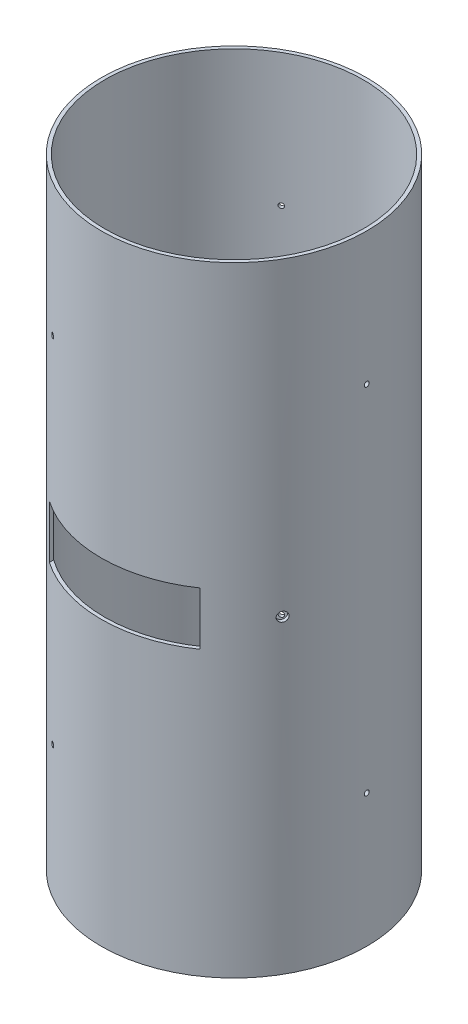
from build123d import *

# Parameters (mm, degrees)
SKETCH1_R               = 76.2
SKETCH1_R_2             = 74.168
BOSS_EXTRUDE1_DEPTH     = 355.6
SKETCH2_W               = 86.36
SKETCH2_H               = 30.48
CUT_EXTRUDE1_DEPTH      = 90.424
SKETCH3_R               = 2.7305
CUT_EXTRUDE2_DEPTH      = 2.54
CIRPATTERN1_COUNT       = 4
CIRPATTERN1_ANGLE       = 240
CUT_EXTRUDE3_REACH      = 378.288
CUT_EXTRUDE3_END_RADIUS = 76.2
SKETCH4_R               = 1.41224
CIRPATTERN2_COUNT       = 3


with BuildPart() as part:
    # Sketch1 → Boss-Extrude1 (new body)
    with BuildSketch(Plane(origin=(0, 0, 0), x_dir=(1, 0, 0), z_dir=(0, 1, 0))):
        with Locations(Location((0, 0, 0), (0, 0, 270))):
            Circle(SKETCH1_R)
        with Locations(Location((0, 0, 0), (0, 0, 270))):
            Circle(SKETCH1_R_2, mode=Mode.SUBTRACT)
    extrude(amount=BOSS_EXTRUDE1_DEPTH)

    # Sketch2 → Cut-Extrude1 (cut)
    with BuildSketch(Plane.XY):
        with Locations((0, 177.8)):
            Rectangle(SKETCH2_W, SKETCH2_H)
    extrude(amount=CUT_EXTRUDE1_DEPTH, mode=Mode.SUBTRACT)

    # Sketch3 → Cut-Extrude2 (cut)
    with BuildSketch(Plane(origin=(-65.991135768, 0, 38.1), x_dir=(0, -1, 0), z_dir=(-0.8660254037844416, 0, 0.49999999999999495))):
        with Locations(Location((-177.8, 0, 0), (0, 0, 90))):
            Circle(SKETCH3_R)
    cut_extrude2 = extrude(amount=-CUT_EXTRUDE2_DEPTH, mode=Mode.SUBTRACT)

    # CirPattern1: Cut-Extrude2 ×4 about axis
    cirpattern1_axis = Axis((0, 355.6, 0), (0, -1, 0))
    for i in range(1, CIRPATTERN1_COUNT):
        add(cut_extrude2.rotate(cirpattern1_axis, i * CIRPATTERN1_ANGLE / (CIRPATTERN1_COUNT - 1)), mode=Mode.SUBTRACT)

    # Cut-Extrude3: up to this cylinder (the profile starts inside it)
    cut_extrude3_end = Plane(origin=(0, 177.8, 0), z_dir=(0, -1, 0)) * Cylinder(CUT_EXTRUDE3_END_RADIUS, 1113.176, mode=Mode.PRIVATE)
    # Sketch4 → Cut-Extrude3 (cut, up to the surface)
    with BuildSketch(Plane(origin=(0, 0, 20.417728463), x_dir=(0, -1, 0), z_dir=(-1, 0, 0)), mode=Mode.PRIVATE) as cut_extrude3_sk1:
        with Locations(Location((-76.2, -20.417728463, 0), (0, 0, 90))):
            Circle(SKETCH4_R)
    cut_extrude3_tool1 = extrude(cut_extrude3_sk1.sketch, amount=-CUT_EXTRUDE3_REACH, mode=Mode.PRIVATE) & cut_extrude3_end
    # Sketch4 → Cut-Extrude3 (cut, up to the surface)
    with BuildSketch(Plane(origin=(0, 0, 20.417728463), x_dir=(0, -1, 0), z_dir=(-1, 0, 0)), mode=Mode.PRIVATE) as cut_extrude3_sk2:
        with Locations(Location((-279.4, -20.417728463, 0), (0, 0, 90))):
            Circle(SKETCH4_R)
    cut_extrude3_tool2 = extrude(cut_extrude3_sk2.sketch, amount=-CUT_EXTRUDE3_REACH, mode=Mode.PRIVATE) & cut_extrude3_end
    cut_extrude3 = cut_extrude3_tool1.solids().sort_by_distance((0, 76.2, 0))[0] + cut_extrude3_tool2.solids().sort_by_distance((0, 279.4, 0))[0]
    add(cut_extrude3, mode=Mode.SUBTRACT)

    # CirPattern2: Cut-Extrude3 ×3 about axis
    cirpattern2_axis = Axis((0, 355.6, 0), (0, 1, 0))
    for i in range(1, CIRPATTERN2_COUNT):
        add(cut_extrude3.rotate(cirpattern2_axis, i * 360 / CIRPATTERN2_COUNT), mode=Mode.SUBTRACT)


solid = part.part
